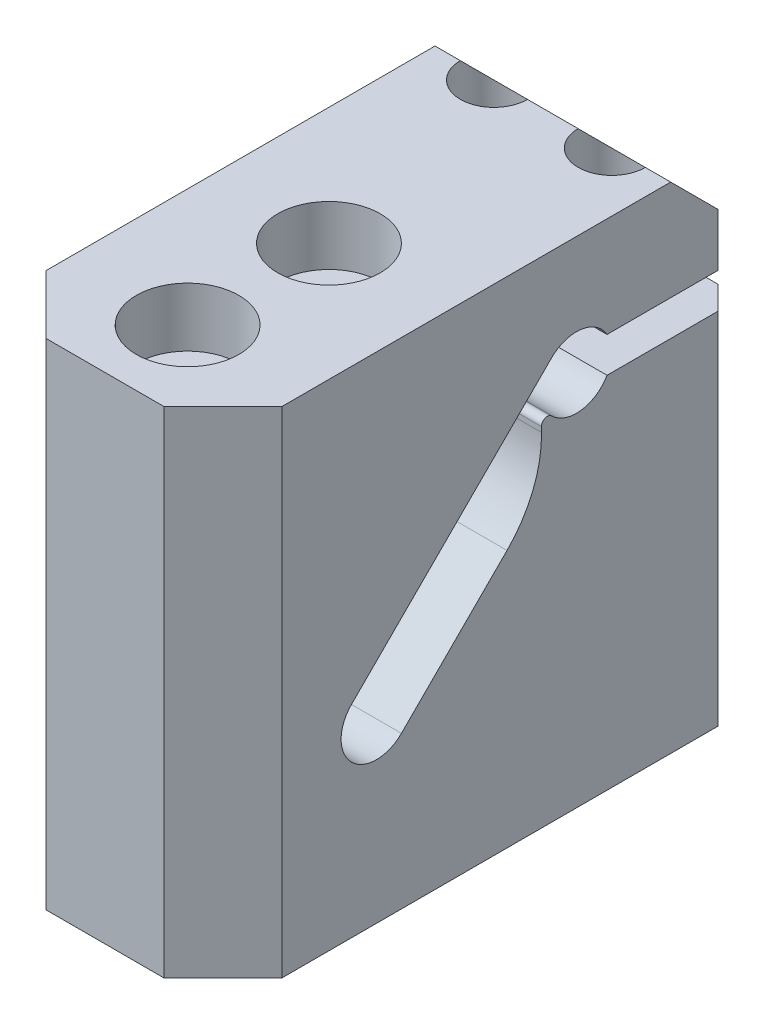
from build123d import *

# Parameters (mm, degrees)
EXTRUDE_1_DEPTH     = 20
FILLET_1_R          = 10
FILLET_2_R          = 0.5
SKETCH_2_R          = 4.35
SKETCH_2_R_2        = 2.5
CUT_EXTRUDE_1_DEPTH = 5
SKETCH_2_3_R        = 2.85
SKETCH_2_3_R_2      = 1.5
CUT_EXTRUDE_2_DEPTH = 5
SKETCH_2_4_R        = 2.5
SKETCH_2_4_R_2      = 1.5
CUT_EXTRUDE_3_DEPTH = 56.353410012
CHAMFER_1_SIZE      = 5
CHAMFER_2_SIZE      = 2


with BuildPart() as part:
    # 스케치1 → 보스-돌출1 (new body)
    with BuildSketch(Plane(origin=(0, 0, 0), x_dir=(0, 0, -1), z_dir=(1, 0, 0))):
        with BuildLine():
            ThreePointArc((-14.849242405, -19.091883092), (-19.091883092, -19.091883092), (-19.091883092, -14.849242405))
            Line((-19.091883092, -14.849242405), (-2.121320344, 2.121320344))
            ThreePointArc((-2.121320344, 2.121320344), (0.391578577, 2.974334584), (2.598076211, 1.5))
            Line((2.598076211, 1.5), (14, 1.5))
            Line((14, 1.5), (14, 4))
            Line((14, 4), (8, 10))
            Line((8, 10), (-30, 10))
            Line((-30, 10), (-30, -32))
            Line((-30, -32), (14, -32))
            Line((14, -32), (14, -1.5))
            Line((14, -1.5), (2.598076211, -1.5))
            ThreePointArc((2.598076211, -1.5), (-0.737259989, -2.907997199), (-2.998906144, -0.081005802))
            Line((-2.998906144, -0.081005802), (-2.903502563, -7.14614325))
            Line((-2.903502563, -7.14614325), (-14.849242405, -19.091883092))
        make_face()
    extrude(amount=EXTRUDE_1_DEPTH)

    # 필렛1
    fillet_1_edges = [part.edges().sort_by_distance(p)[0] for p in [
        (10, -7.14614325, 2.903502563),
    ]]
    fillet(fillet_1_edges, radius=FILLET_1_R)

    # 필렛2
    fillet_2_edges = [part.edges().sort_by_distance(p)[0] for p in [
        (10, -0.081005802, 2.998906144),
    ]]
    fillet(fillet_2_edges, radius=FILLET_2_R)

    # 스케치2 → 컷-돌출1 (cut)
    # profile 1 of 2: a face of its own
    with BuildSketch(Plane(origin=(0, 10, 0), x_dir=(1, 0, 0), z_dir=(0, 1, 0))):
        with Locations((10, -11)):
            Circle(SKETCH_2_R)
        with Locations((10, -11)):
            Circle(SKETCH_2_R_2, mode=Mode.SUBTRACT)
    # profile 2 of 2: a face of its own
    with BuildSketch(Plane(origin=(0, 10, 0), x_dir=(1, 0, 0), z_dir=(0, 1, 0))):
        with Locations((10, -23)):
            Circle(SKETCH_2_R)
        with Locations((10, -23)):
            Circle(SKETCH_2_R_2, mode=Mode.SUBTRACT)
    extrude(amount=-CUT_EXTRUDE_1_DEPTH, mode=Mode.SUBTRACT)

    # 스케치2<3> → 컷-돌출2 (cut)
    # profile 1 of 2: a face of its own
    with BuildSketch(Plane(origin=(0, 10, 0), x_dir=(1, 0, 0), z_dir=(0, 1, 0))):
        with Locations((5, 8)):
            Circle(SKETCH_2_3_R)
        with Locations((5, 8)):
            Circle(SKETCH_2_3_R_2, mode=Mode.SUBTRACT)
    # profile 2 of 2: a face of its own
    with BuildSketch(Plane(origin=(0, 10, 0), x_dir=(1, 0, 0), z_dir=(0, 1, 0))):
        with Locations((15, 8)):
            Circle(SKETCH_2_3_R)
        with Locations((15, 8)):
            Circle(SKETCH_2_3_R_2, mode=Mode.SUBTRACT)
    extrude(amount=-CUT_EXTRUDE_2_DEPTH, mode=Mode.SUBTRACT)

    # 스케치2<4> → 컷-돌출3 (cut, through all)
    with BuildSketch(Plane(origin=(0, 10, 0), x_dir=(1, 0, 0), z_dir=(0, 1, 0))):
        with Locations((10, -11)):
            Circle(SKETCH_2_4_R)
        with Locations((15, 8)):
            Circle(SKETCH_2_4_R_2)
        with Locations((5, 8)):
            Circle(SKETCH_2_4_R_2)
        with Locations((10, -23)):
            Circle(SKETCH_2_4_R)
    extrude(amount=-CUT_EXTRUDE_3_DEPTH, mode=Mode.SUBTRACT)

    # 모따기1
    chamfer_1_edges = [part.edges().sort_by_distance(p)[0] for p in [
        (20, -11, 30),
        (0, -11, 30),
    ]]
    chamfer(chamfer_1_edges, length=CHAMFER_1_SIZE)

    # 모따기2
    chamfer_2_edges = [part.edges().sort_by_distance(p)[0] for p in [
        (0, -16.75, -14),
        (0, 2.75, -14),
        (20, 2.75, -14),
        (20, -16.75, -14),
    ]]
    chamfer(chamfer_2_edges, length=CHAMFER_2_SIZE)


solid = part.part
